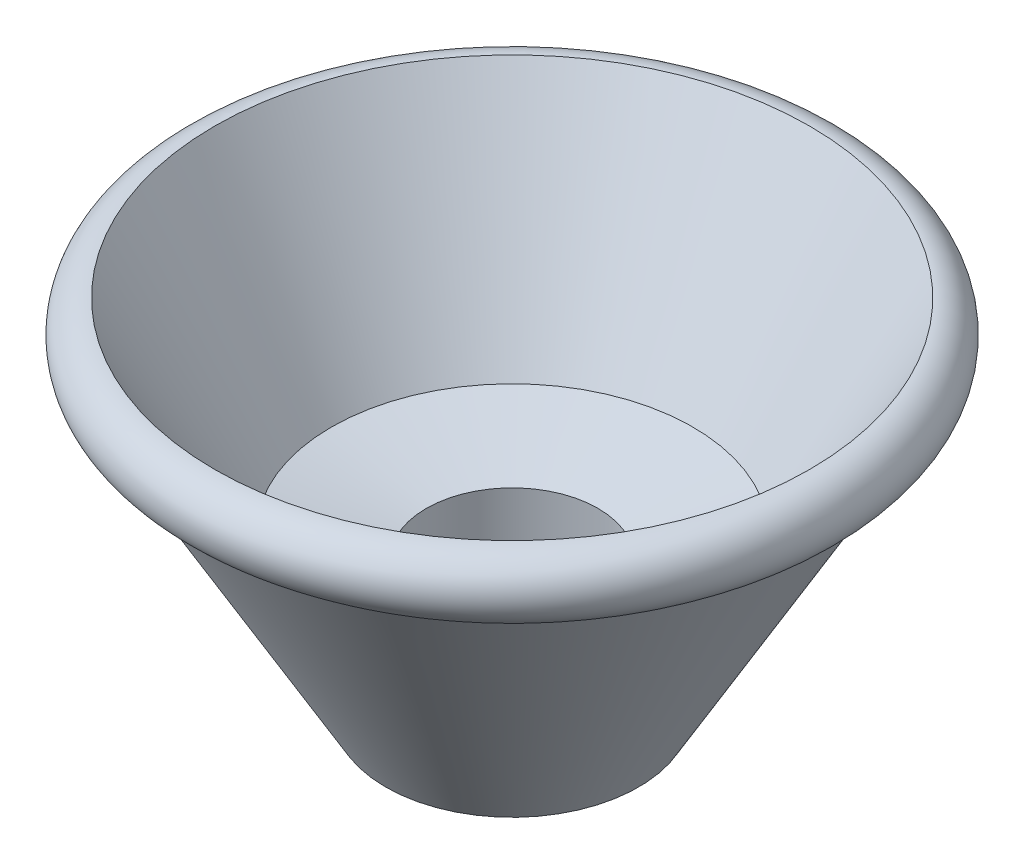
from build123d import *

# Parameters (mm, degrees)
EXTRUDE_1_DEPTH          = 0.6
EXTRUDE_1_DEPTH_BACK     = 6
SKETCH_5_R               = 0.31
SKETCH_7_R               = 0.28
CUT_EXTRUDE_2_DEPTH      = 16.448840302
CUT_EXTRUDE_3_DEPTH      = 10
CUT_EXTRUDE_3_DEPTH_BACK = 10


with BuildPart() as part:
    # 草图2 → 旋转1 (revolve)
    with BuildSketch(Plane.XY):
        Polygon((0, 0), (-4.618802154, 8), (0, 8), align=None)
    revolve(axis=Axis((0, -55.266670228, 0), (0, 1, 0)))

    # 草图5 → 凸台-拉伸1 (add, two sides: drawn at the far end of the back side and taken through both)
    with BuildSketch(Plane(origin=(0, 0, 0), x_dir=(1, 0, 0), z_dir=(0, 1, 0)).offset(-EXTRUDE_1_DEPTH_BACK)):
        Circle(SKETCH_5_R)
    extrude(amount=EXTRUDE_1_DEPTH + EXTRUDE_1_DEPTH_BACK)

    # 草图7 → 切除-拉伸2 (cut, through all)
    with BuildSketch(Plane.XZ.offset(6)):
        Circle(SKETCH_7_R)
    extrude(amount=-CUT_EXTRUDE_2_DEPTH, mode=Mode.SUBTRACT)

    # 草图4 → 切除-旋转2 (revolve, cut)
    with BuildSketch(Plane.XY):
        Polygon((0, 8), (-4.041451884, 8), (0, 1), align=None)
    revolve(axis=Axis((0, 7.19521629, 0), (0, 1, 0)), mode=Mode.SUBTRACT)

    # 草图10 → 旋转3 (revolve)
    with BuildSketch(Plane.XY):
        with BuildLine():
            ThreePointArc((-4.618802154, 9), (-5.118802154, 8.5), (-4.618802154, 8))
            Line((-4.618802154, 8), (-4.041451884, 8))
            Line((-4.041451884, 8), (-4.041451884, 9))
            Line((-4.041451884, 9), (-4.618802154, 9))
        make_face()
    revolve(axis=Axis((0, 0, 0), (0, 1, 0)))

    # 草图11 → 切除-旋转3 (revolve, cut)
    with BuildSketch(Plane.XY):
        Polygon((-4.041451884, 8), (-4.932498772, 9.543338481), (-1.781160805, 9.543338481), (-1.781160805, 8), align=None)
    revolve(axis=Axis((0, 0, 0), (0, 1, 0)), mode=Mode.SUBTRACT)

    # 草图14 → 旋转4 (revolve)
    with BuildSketch(Plane.XY):
        Polygon((0.325, 3.401430976), (0.325, 3.751430976), (2.165889684, 3.751430976), (1.963817089, 3.401430976), align=None)
    revolve(axis=Axis((0, 0, 0), (0, 1, 0)))

    # 草图16 → 切除-拉伸3 (cut, two sides: drawn at the far end of the back side and taken through both)
    with BuildSketch(Plane.XY.offset(-CUT_EXTRUDE_3_DEPTH_BACK)):
        Polygon((1.38646682, 3.401430976), (4.735566884, 3.401430976), (4.735566884, -6.564906042), (-5.830144142, -6.564906042), (-5.830144142, 3.401430976), align=None)
    extrude(amount=CUT_EXTRUDE_3_DEPTH + CUT_EXTRUDE_3_DEPTH_BACK, mode=Mode.SUBTRACT)

    # 草图21 → 旋转5 (revolve)
    with BuildSketch(Plane.XY):
        Polygon((1.588539414, 3.751430976), (1.588539414, 5.341161575), (1.588539414, 5.501161575), (1.333683802, 5.501161575), (2.805566179, 5.859383166), (2.698088002, 5.673225503), align=None)
    revolve(axis=Axis((0, 0.062644637, 0), (0, 1, 0)))


solid = part.part
